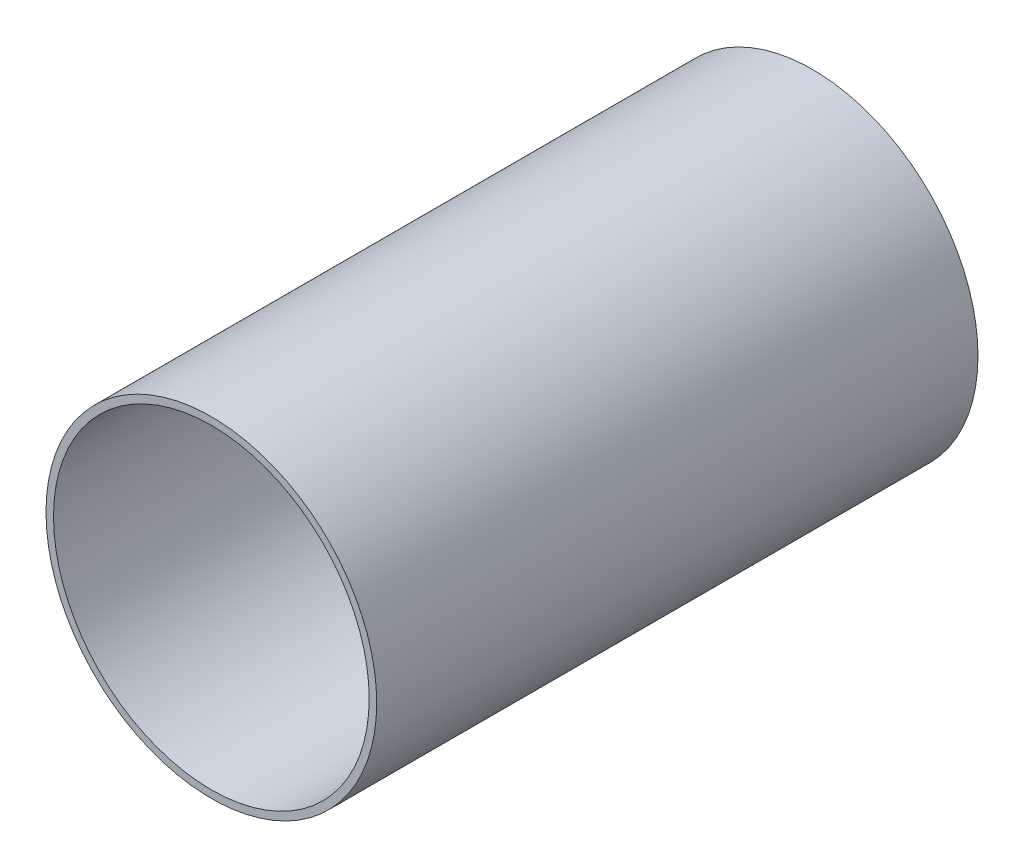
from build123d import *

# Parameters (mm, degrees)
SKETCH2_R           = 55
SKETCH2_R_2         = 52.5
BOSS_EXTRUDE1_DEPTH = 200


with BuildPart() as part:
    # Sketch2 → Boss-Extrude1 (new body)
    with BuildSketch(Plane.XY):
        Circle(SKETCH2_R)
        Circle(SKETCH2_R_2, mode=Mode.SUBTRACT)
    extrude(amount=BOSS_EXTRUDE1_DEPTH)


solid = part.part
